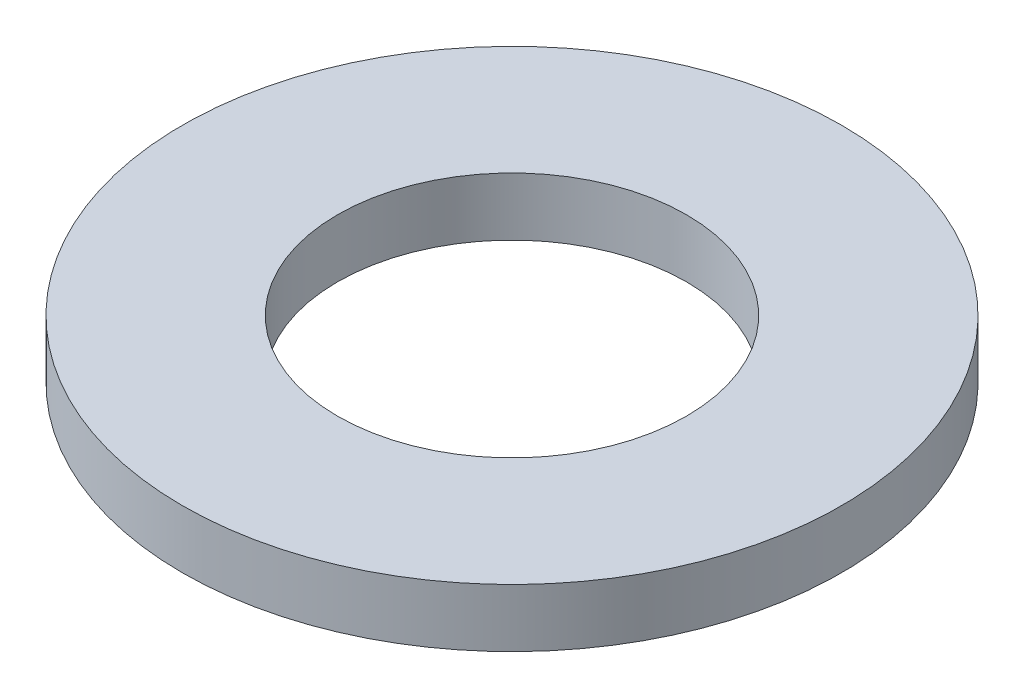
from build123d import *

# Parameters (mm, degrees)
SKETCH1_R           = 8.5
SKETCH1_R_2         = 4.5
BOSS_EXTRUDE1_DEPTH = 1.5


with BuildPart() as part:
    # Sketch1 → Boss-Extrude1 (new body)
    with BuildSketch(Plane(origin=(0, 0, 0), x_dir=(1, 0, 0), z_dir=(0, 1, 0))):
        with Locations(Location((0, 0, 0), (0, 0, 270))):
            Circle(SKETCH1_R)
        with Locations(Location((0, 0, 0), (0, 0, 270))):
            Circle(SKETCH1_R_2, mode=Mode.SUBTRACT)
    extrude(amount=BOSS_EXTRUDE1_DEPTH)


solid = part.part
